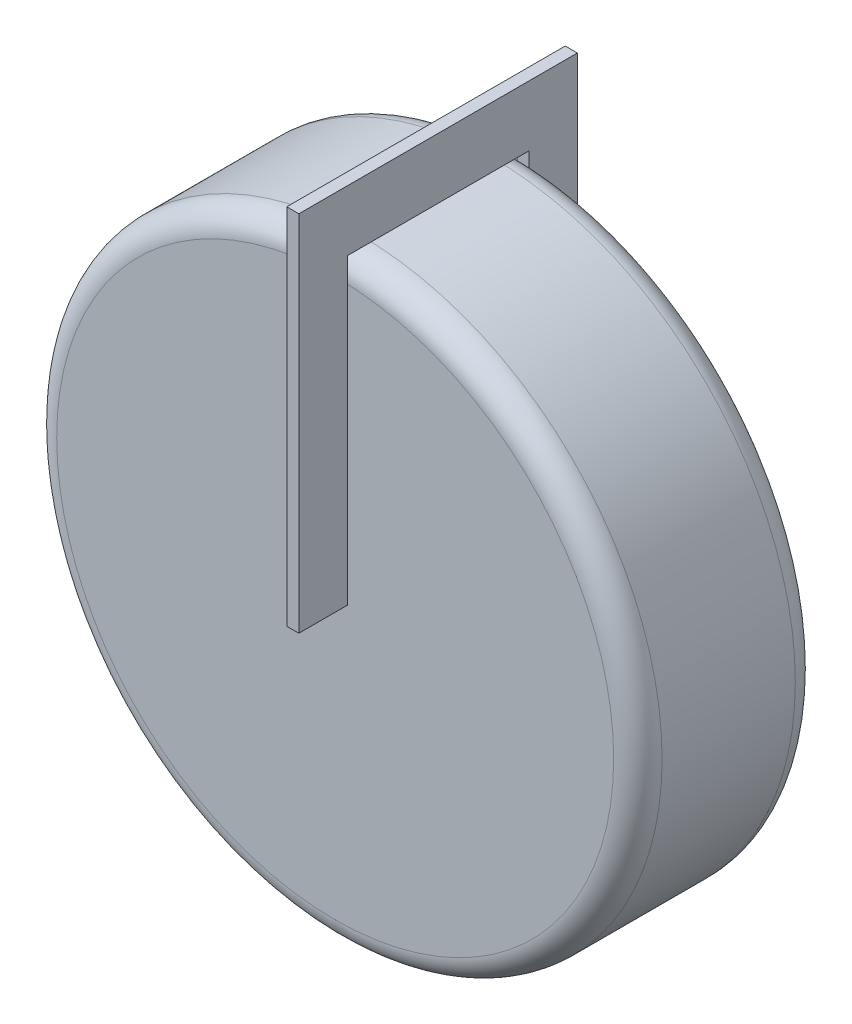
from build123d import *

# Parameters (mm, degrees)
SKETCH1_R           = 25
BOSS_EXTRUDE1_DEPTH = 15
SKETCH2_W           = 15
SKETCH2_H           = 5
SKETCH2_W_2         = 4
SKETCH2_H_2         = 30
BOSS_EXTRUDE3_DEPTH = 1
FILLET1_R           = 2


with BuildPart() as part:
    # Sketch1 → Boss-Extrude1 (new body)
    with BuildSketch(Plane.XY):
        Circle(SKETCH1_R)
    extrude(amount=BOSS_EXTRUDE1_DEPTH)

    # Fillet1
    fillet1_edges = [part.edges().sort_by_distance(p)[0] for p in [
        (-25, 0, 0),
        (-25, 0, 15),
    ]]
    fillet(fillet1_edges, radius=FILLET1_R)


with BuildPart() as body_2:
    # Sketch2 → Boss-Extrude3 (new body)
    with BuildSketch(Plane(origin=(0, 0, 0), x_dir=(0, 0, -1), z_dir=(1, 0, 0))):
        Polygon((-15, 0), (-15, 25), (-15, 30), (-19, 30), (-19, 0), align=None)
        with Locations((-7.5, 27.5)):
            Rectangle(SKETCH2_W, SKETCH2_H)
        with Locations((2, 15)):
            Rectangle(SKETCH2_W_2, SKETCH2_H_2)
    extrude(amount=BOSS_EXTRUDE3_DEPTH)


solid = Compound([part.part, body_2.part])
